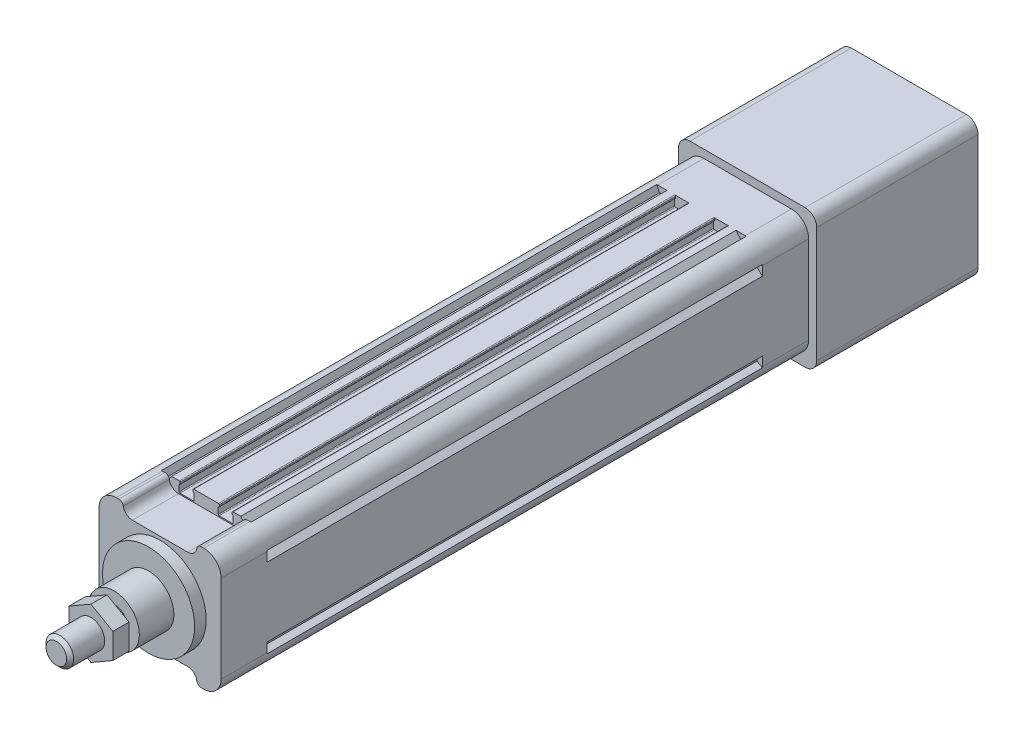
from build123d import *

# Parameters (mm, degrees)
SKETCH_1_R             = 2.1
EXTRUDE_1_DEPTH        = 215
EXTRUDE_2_DEPTH        = 20
SKETCH_7_R             = 20
EXTRUDE_3_DEPTH        = 5
SKETCH_9_R             = 11
EXTRUDE_4_DEPTH        = 15
SKETCH_10_R            = 6
EXTRUDE_5_DEPTH        = 25
EXTRUDE_START          = 20
EXTRUDE_6_DEPTH        = 20
EXTRUDE_7_DEPTH        = 70
SKETCH_14_R            = 19
CUT_EXTRUDE_2_DEPTH    = 70
HOLE_WIZARD_M6_1_D     = 5
HOLE_WIZARD_M6_1_DEPTH = 15
HOLE_WIZARD_M6_1_TIP   = 1.502151548
CHAMFER_1_SIZE         = 1.5
EXTRUDE_START_2        = 3
EXTRUDE_8_DEPTH        = 7


with BuildPart() as part:
    # 草图1 → 凸台-拉伸1 (new body)
    with BuildSketch(Plane.XY):
        with BuildLine():
            Line((-18.2, 24), (-19.443439638, 26.486879276))
            ThreePointArc((-19.443439638, 26.486879276), (-24.303300859, 24.303300859), (-26.486879276, 19.443439638))
            Line((-26.486879276, 19.443439638), (-24, 18.2))
            Line((-24, 18.2), (-24, 17.1))
            Line((-24, 17.1), (-26.5, 15))
            Line((-26.5, 15), (-26.5, -15))
            Line((-26.5, -15), (-24, -17.1))
            Line((-24, -17.1), (-24, -18.2))
            Line((-24, -18.2), (-26.486879276, -19.443439638))
            ThreePointArc((-26.486879276, -19.443439638), (-24.303300859, -24.303300859), (-19.443439638, -26.486879276))
            Line((-19.443439638, -26.486879276), (-18.2, -24))
            Line((-18.2, -24), (-17.1, -24))
            Line((-17.1, -24), (-15, -26.5))
            Line((-15, -26.5), (-11.65, -26.5))
            ThreePointArc((-11.65, -26.5), (-11.367157288, -26.382842712), (-11.25, -26.1))
            Line((-11.25, -26.1), (-11.25, -25.6))
            ThreePointArc((-11.25, -25.6), (-11.367157288, -25.317157288), (-11.65, -25.2))
            Line((-11.65, -25.2), (-11.75, -25.2))
            Line((-11.75, -25.2), (-11.75, -22.4))
            ThreePointArc((-11.75, -22.4), (-11.632842712, -22.117157288), (-11.35, -22))
            Line((-11.35, -22), (-5.65, -22))
            ThreePointArc((-5.65, -22), (-5.367157288, -22.117157288), (-5.25, -22.4))
            Line((-5.25, -22.4), (-5.25, -25.2))
            Line((-5.25, -25.2), (-5.35, -25.2))
            ThreePointArc((-5.35, -25.2), (-5.632842712, -25.317157288), (-5.75, -25.6))
            Line((-5.75, -25.6), (-5.75, -26.1))
            ThreePointArc((-5.75, -26.1), (-5.632842712, -26.382842712), (-5.35, -26.5))
            Line((-5.35, -26.5), (5.35, -26.5))
            ThreePointArc((5.35, -26.5), (5.632842712, -26.382842712), (5.75, -26.1))
            Line((5.75, -26.1), (5.75, -25.6))
            ThreePointArc((5.75, -25.6), (5.632842712, -25.317157288), (5.35, -25.2))
            Line((5.35, -25.2), (5.25, -25.2))
            Line((5.25, -25.2), (5.25, -22.4))
            ThreePointArc((5.25, -22.4), (5.367157288, -22.117157288), (5.65, -22))
            Line((5.65, -22), (11.35, -22))
            ThreePointArc((11.35, -22), (11.632842712, -22.117157288), (11.75, -22.4))
            Line((11.75, -22.4), (11.75, -25.2))
            Line((11.75, -25.2), (11.65, -25.2))
            ThreePointArc((11.65, -25.2), (11.367157288, -25.317157288), (11.25, -25.6))
            Line((11.25, -25.6), (11.25, -26.1))
            ThreePointArc((11.25, -26.1), (11.367157288, -26.382842712), (11.65, -26.5))
            Line((11.65, -26.5), (15, -26.5))
            Line((15, -26.5), (17.1, -24))
            Line((17.1, -24), (18.2, -24))
            Line((18.2, -24), (19.443439638, -26.486879276))
            ThreePointArc((19.443439638, -26.486879276), (24.303300859, -24.303300859), (26.486879276, -19.443439638))
            Line((26.486879276, -19.443439638), (24, -18.2))
            Line((24, -18.2), (24, -17.1))
            Line((24, -17.1), (26.5, -15))
            Line((26.5, -15), (26.5, 15))
            Line((26.5, 15), (24, 17.1))
            Line((24, 17.1), (24, 18.2))
            Line((24, 18.2), (26.486879276, 19.443439638))
            ThreePointArc((26.486879276, 19.443439638), (24.303300859, 24.303300859), (19.443439638, 26.486879276))
            Line((19.443439638, 26.486879276), (18.2, 24))
            Line((18.2, 24), (17.1, 24))
            Line((17.1, 24), (15, 26.5))
            Line((15, 26.5), (11.65, 26.5))
            ThreePointArc((11.65, 26.5), (11.367157288, 26.382842712), (11.25, 26.1))
            Line((11.25, 26.1), (11.25, 25.6))
            ThreePointArc((11.25, 25.6), (11.367157288, 25.317157288), (11.65, 25.2))
            Line((11.65, 25.2), (11.75, 25.2))
            Line((11.75, 25.2), (11.75, 22.4))
            ThreePointArc((11.75, 22.4), (11.632842712, 22.117157288), (11.35, 22))
            Line((11.35, 22), (5.65, 22))
            ThreePointArc((5.65, 22), (5.367157288, 22.117157288), (5.25, 22.4))
            Line((5.25, 22.4), (5.25, 25.2))
            Line((5.25, 25.2), (5.35, 25.2))
            ThreePointArc((5.35, 25.2), (5.632842712, 25.317157288), (5.75, 25.6))
            Line((5.75, 25.6), (5.75, 26.1))
            ThreePointArc((5.75, 26.1), (5.632842712, 26.382842712), (5.35, 26.5))
            Line((5.35, 26.5), (-5.35, 26.5))
            ThreePointArc((-5.35, 26.5), (-5.632842712, 26.382842712), (-5.75, 26.1))
            Line((-5.75, 26.1), (-5.75, 25.6))
            ThreePointArc((-5.75, 25.6), (-5.632842712, 25.317157288), (-5.35, 25.2))
            Line((-5.35, 25.2), (-5.25, 25.2))
            Line((-5.25, 25.2), (-5.25, 22.4))
            ThreePointArc((-5.25, 22.4), (-5.367157288, 22.117157288), (-5.65, 22))
            Line((-5.65, 22), (-11.35, 22))
            ThreePointArc((-11.35, 22), (-11.632842712, 22.117157288), (-11.75, 22.4))
            Line((-11.75, 22.4), (-11.75, 25.2))
            Line((-11.75, 25.2), (-11.65, 25.2))
            ThreePointArc((-11.65, 25.2), (-11.367157288, 25.317157288), (-11.25, 25.6))
            Line((-11.25, 25.6), (-11.25, 26.1))
            ThreePointArc((-11.25, 26.1), (-11.367157288, 26.382842712), (-11.65, 26.5))
            Line((-11.65, 26.5), (-15, 26.5))
            Line((-15, 26.5), (-17.1, 24))
            Line((-17.1, 24), (-18.2, 24))
        make_face()
        with Locations((19, 19)):
            Circle(SKETCH_1_R, mode=Mode.SUBTRACT)
        with Locations((19, -19)):
            Circle(SKETCH_1_R, mode=Mode.SUBTRACT)
        with Locations((-19, -19)):
            Circle(SKETCH_1_R, mode=Mode.SUBTRACT)
        with Locations((-19, 19)):
            Circle(SKETCH_1_R, mode=Mode.SUBTRACT)
        with BuildLine():
            Line((19.773719933, 3), (23.3, 3))
            Line((23.3, 3), (23.3, -3))
            Line((23.3, -3), (19.773719933, -3))
            ThreePointArc((19.773719933, -3), (0, -20), (-19.773719933, -3))
            Line((-19.773719933, -3), (-23.3, -3))
            Line((-23.3, -3), (-23.3, 3))
            Line((-23.3, 3), (-19.773719933, 3))
            ThreePointArc((-19.773719933, 3), (0, 20), (19.773719933, 3))
        make_face(mode=Mode.SUBTRACT)
    extrude(amount=EXTRUDE_1_DEPTH)

    # 草图6 → 凸台-拉伸2 (add)
    with BuildSketch(Plane.XY.offset(215)):
        with BuildLine():
            Line((-26.5, -19), (-26.5, 19))
            ThreePointArc((-26.5, 19), (-24.303300859, 24.303300859), (-19, 26.5))
            Line((-19, 26.5), (-17.916079783, 26.5))
            ThreePointArc((-17.916079783, 26.5), (-16.625085334, 26.027525232), (-15.944053189, 24.833333333))
            ThreePointArc((-15.944053189, 24.833333333), (-14.581988897, 22.444949537), (-12, 21.5))
            Line((-12, 21.5), (12, 21.5))
            ThreePointArc((12, 21.5), (14.581988897, 22.444949537), (15.944053189, 24.833333333))
            ThreePointArc((15.944053189, 24.833333333), (16.625085334, 26.027525232), (17.916079783, 26.5))
            Line((17.916079783, 26.5), (19, 26.5))
            ThreePointArc((19, 26.5), (24.303300859, 24.303300859), (26.5, 19))
            Line((26.5, 19), (26.5, -19))
            ThreePointArc((26.5, -19), (24.303300859, -24.303300859), (19, -26.5))
            Line((19, -26.5), (17.916079783, -26.5))
            ThreePointArc((17.916079783, -26.5), (16.625085334, -26.027525232), (15.944053189, -24.833333333))
            ThreePointArc((15.944053189, -24.833333333), (14.581988897, -22.444949537), (12, -21.5))
            Line((12, -21.5), (-12, -21.5))
            ThreePointArc((-12, -21.5), (-14.581988897, -22.444949537), (-15.944053189, -24.833333333))
            ThreePointArc((-15.944053189, -24.833333333), (-16.625085334, -26.027525232), (-17.916079783, -26.5))
            Line((-17.916079783, -26.5), (-19, -26.5))
            ThreePointArc((-19, -26.5), (-24.303300859, -24.303300859), (-26.5, -19))
        make_face()
    extrude(amount=EXTRUDE_2_DEPTH)

    # 草图7 → 凸台-拉伸3 (add)
    with BuildSketch(Plane.XY.offset(235)):
        Circle(SKETCH_7_R)
    extrude(amount=EXTRUDE_3_DEPTH)

    # 草图9 → 凸台-拉伸4 (add)
    with BuildSketch(Plane.XY.offset(240)):
        Circle(SKETCH_9_R)
    extrude(amount=EXTRUDE_4_DEPTH)

    # 草图10 → 凸台-拉伸5 (add)
    with BuildSketch(Plane.XY.offset(255)):
        Circle(SKETCH_10_R)
    extrude(amount=EXTRUDE_5_DEPTH)

    # 草图11 → 凸台-拉伸6 (add)
    with BuildSketch(Plane(origin=(0, 0, 0), x_dir=(-1, 0, 0), z_dir=(0, 0, -1)).offset(EXTRUDE_START)):
        with BuildLine():
            Line((-19, -26.5), (19, -26.5))
            ThreePointArc((19, -26.5), (24.303300859, -24.303300859), (26.5, -19))
            Line((26.5, -19), (26.5, 19))
            ThreePointArc((26.5, 19), (24.303300859, 24.303300859), (19, 26.5))
            Line((19, 26.5), (-19, 26.5))
            ThreePointArc((-19, 26.5), (-24.303300859, 24.303300859), (-26.5, 19))
            Line((-26.5, 19), (-26.5, -19))
            ThreePointArc((-26.5, -19), (-24.303300859, -24.303300859), (-19, -26.5))
        make_face()
    extrude(amount=-EXTRUDE_6_DEPTH)

    # 草图12 → 凸台-拉伸7 (add)
    with BuildSketch(Plane(origin=(0, 0, -20), x_dir=(-1, 0, 0), z_dir=(0, 0, -1))):
        with BuildLine():
            Line((-25, -30), (25, -30))
            ThreePointArc((25, -30), (28.535533906, -28.535533906), (30, -25))
            Line((30, -25), (30, 25))
            ThreePointArc((30, 25), (28.535533906, 28.535533906), (25, 30))
            Line((25, 30), (-25, 30))
            ThreePointArc((-25, 30), (-28.535533906, 28.535533906), (-30, 25))
            Line((-30, 25), (-30, -25))
            ThreePointArc((-30, -25), (-28.535533906, -28.535533906), (-25, -30))
        make_face()
    extrude(amount=EXTRUDE_7_DEPTH)

    # 草图14 → 切除-拉伸2 (cut)
    with BuildSketch(Plane(origin=(0, 0, -90), x_dir=(-1, 0, 0), z_dir=(0, 0, -1))):
        Circle(SKETCH_14_R)
    extrude(amount=-CUT_EXTRUDE_2_DEPTH, mode=Mode.SUBTRACT)

    # M6 螺纹孔1
    with Locations(Plane.ZY.offset(26.5)):
        with Locations((225, 11), (225, -11), (-10, 11), (-10, -11)):
            Hole(HOLE_WIZARD_M6_1_D / 2, depth=HOLE_WIZARD_M6_1_DEPTH)
            with Locations((0, 0, -(HOLE_WIZARD_M6_1_DEPTH + HOLE_WIZARD_M6_1_TIP / 2))):  # 118° drill point
                Cone(0, HOLE_WIZARD_M6_1_D / 2, HOLE_WIZARD_M6_1_TIP, mode=Mode.SUBTRACT)

    # 倒角1
    chamfer_1_edges = [part.edges().sort_by_distance(p)[0] for p in [
        (-6, 0, 280),
    ]]
    chamfer(chamfer_1_edges, length=CHAMFER_1_SIZE)

    # 草图17 → 凸台-拉伸8 (add)
    with BuildSketch(Plane.XY.offset(255).offset(EXTRUDE_START_2)):
        Polygon((0, 10.969655115), (-9.5, 5.484827557), (-9.5, -5.484827557), (0, -10.969655115), (9.5, -5.484827557), (9.5, 5.484827557), align=None)
    extrude(amount=EXTRUDE_8_DEPTH)


solid = part.part
